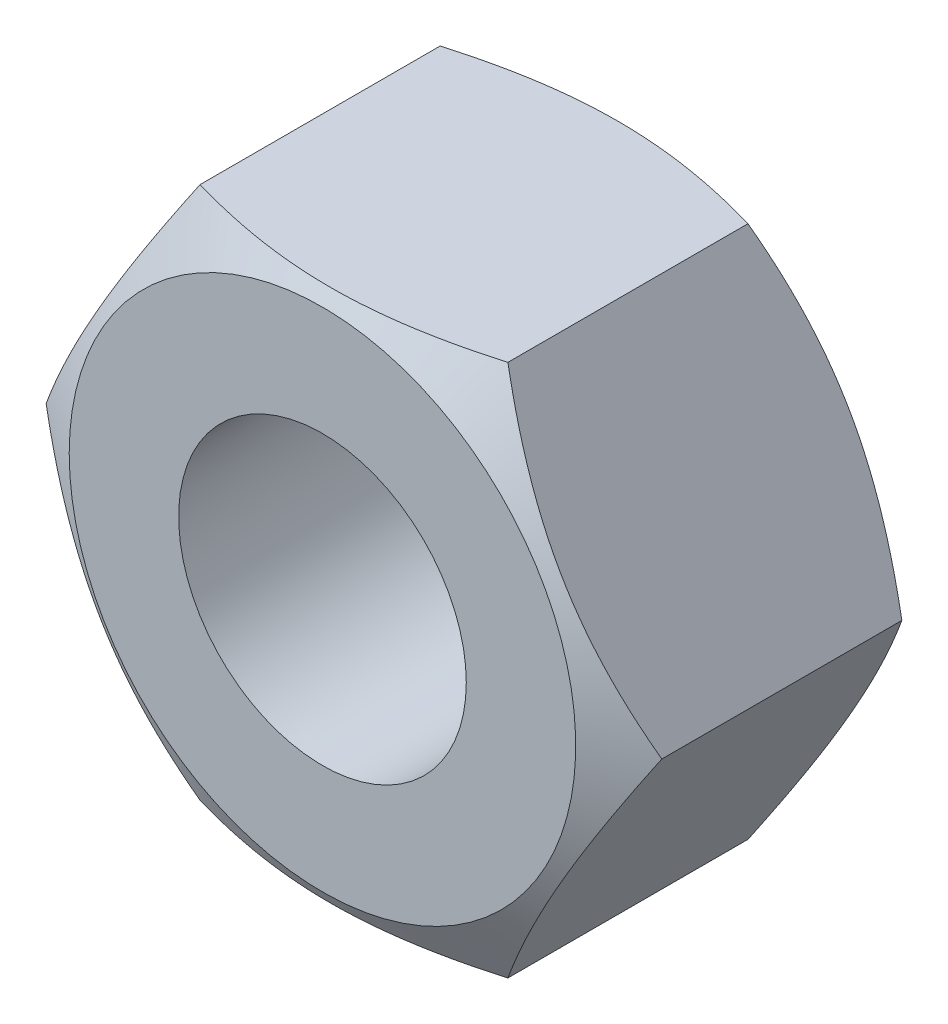
from build123d import *

# Parameters (mm, degrees)
BASENUTSKE_R            = 5.125
BASENUT_DEPTH           = 10.8
SKETCH6_OUTSIDE_W       = 96.26
SKETCH6_OUTSIDE_H       = 93.32
SKETCH6_OUTSIDE_R       = 9.025
CUT_EXTRUDE2_DEPTH      = 19.089315447
CUT_EXTRUDE2_DRAFT      = -60
MIRROR1_COPY_1_SKETCH_W = 96.26
MIRROR1_COPY_1_SKETCH_H = 93.32
MIRROR1_COPY_1_SKETCH_R = 9.025
MIRROR1_COPY_1_DEPTH    = 19.089315447
MIRROR1_COPY_1_DRAFT    = -60


with BuildPart() as part:
    # BaseNutSke → BaseNut (new body)
    with BuildSketch(Plane.XY):
        Polygon((5.484827557, -9.5), (-5.484827557, -9.5), (-10.969655115, 0), (-5.484827557, 9.5), (5.484827557, 9.5), (10.969655115, 0), align=None)
        Circle(BASENUTSKE_R, mode=Mode.SUBTRACT)
    extrude(amount=-BASENUT_DEPTH)


with BuildPart() as cut_extrude2_tool:
    # Sketch6 outside → Cut-Extrude2 (with draft: the straight prism first)
    with BuildSketch(Plane(origin=(0, 0, -10.8), x_dir=(-1, 0, 0), z_dir=(0, 0, -1))):
        Rectangle(SKETCH6_OUTSIDE_W, SKETCH6_OUTSIDE_H)
        Circle(SKETCH6_OUTSIDE_R, mode=Mode.SUBTRACT)
    extrude(amount=-CUT_EXTRUDE2_DEPTH)
    # Cut-Extrude2: the draft: its side faces are tilted about the plane it starts from
    cut_extrude2_sides = [cut_extrude2_tool.faces().sort_by_distance(p)[0] for p in [
        (0, -46.66, -1.255342277),
        (-48.13, 0, -1.255342277),
        (0, 46.66, -1.255342277),
        (48.13, 0, -1.255342277),
        (9.025, 0, -1.255342277),
    ]]
    draft(cut_extrude2_sides, Plane(origin=(0, 0, -10.8), x_dir=(-1, 0, 0), z_dir=(0, 0, -1)), CUT_EXTRUDE2_DRAFT)


with BuildPart() as part_1:
    add(part.part)

    # Cut-Extrude2: cut by cut_extrude2_tool
    add(cut_extrude2_tool.part, mode=Mode.SUBTRACT)


with BuildPart() as mirror1_copy_1_tool:
    # Mirror1 copy 1 sketch → Mirror1 copy 1 (with draft: the straight prism first)
    with BuildSketch(Plane(origin=(0, 0, 0), x_dir=(-1, 0, 0), z_dir=(0, 0, 1))):
        Rectangle(MIRROR1_COPY_1_SKETCH_W, MIRROR1_COPY_1_SKETCH_H)
        Circle(MIRROR1_COPY_1_SKETCH_R, mode=Mode.SUBTRACT)
    extrude(amount=-MIRROR1_COPY_1_DEPTH)
    # Mirror1 copy 1: the draft: its side faces are tilted about the plane it starts from
    mirror1_copy_1_sides = [mirror1_copy_1_tool.faces().sort_by_distance(p)[0] for p in [
        (0, -46.66, -9.544657723),
        (-48.13, 0, -9.544657723),
        (0, 46.66, -9.544657723),
        (48.13, 0, -9.544657723),
        (9.025, 0, -9.544657723),
    ]]
    draft(mirror1_copy_1_sides, Plane(origin=(0, 0, 0), x_dir=(-1, 0, 0), z_dir=(0, 0, 1)), MIRROR1_COPY_1_DRAFT)


with BuildPart() as part_2:
    add(part_1.part)

    # Mirror1 copy 1: cut by mirror1_copy_1_tool
    add(mirror1_copy_1_tool.part, mode=Mode.SUBTRACT)


solid = part_2.part
